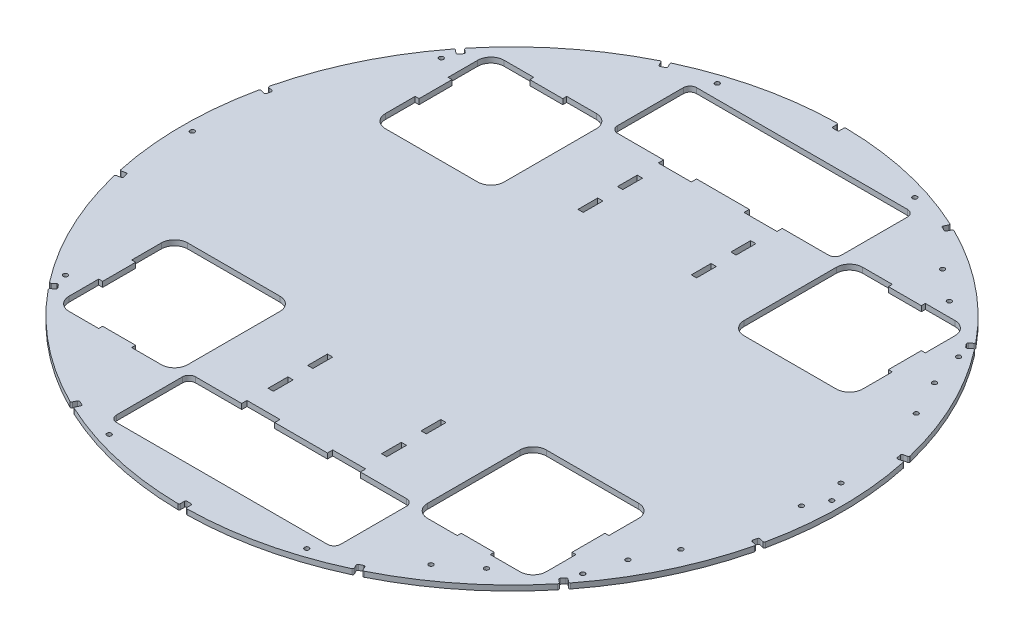
from build123d import *

# Parameters (mm, degrees)
SKETCH1_R                = 250
BOSS_EXTRUDE1_DEPTH      = 4
CUT_EXTRUDE1_DEPTH       = 10
SKETCH3_W                = 25
SKETCH3_H                = 4
CUT_EXTRUDE2_DEPTH       = 5
SKETCH4_W                = 4
SKETCH4_H                = 15
CUT_EXTRUDE3_DEPTH       = 20
CUT_EXTRUDE4_DEPTH       = 5
SKETCH8_W                = 6
SKETCH8_H                = 25
SKETCH8_W_2              = 25
SKETCH8_H_2              = 6
BOSS_EXTRUDE2_DEPTH      = 4
CUT_EXTRUDE5_DEPTH       = 4
FILLET1_R                = 1
CIRPATTERN1_COUNT        = 14
FILLET1_OF_CIRPATTERN1_R = 1
SKETCH12_R               = 1.7
CUT_EXTRUDE6_DEPTH       = 10
CIRPATTERN2_COUNT        = 10
SKETCH13_R               = 1.7
CUT_EXTRUDE7_DEPTH       = 10


with BuildPart() as part:
    # Sketch1 → Boss-Extrude1 (new body)
    with BuildSketch(Plane(origin=(0, 0, 0), x_dir=(1, 0, 0), z_dir=(0, 1, 0))):
        with Locations(Location((0, 0, 0), (0, 0, 270))):
            Circle(SKETCH1_R)
    extrude(amount=BOSS_EXTRUDE1_DEPTH)

    # Sketch2 → Cut-Extrude1 (cut)
    with BuildSketch(Plane(origin=(0, 4, 0), x_dir=(1, 0, 0), z_dir=(0, 1, 0))):
        with BuildLine():
            Line((80, 220), (-80, 220))
            ThreePointArc((-80, 220), (-83.535533906, 218.535533906), (-85, 215))
            Line((-85, 215), (-85, 165))
            ThreePointArc((-85, 165), (-83.535533906, 161.464466094), (-80, 160))
            Line((-80, 160), (80, 160))
            ThreePointArc((80, 160), (83.535533906, 161.464466094), (85, 165))
            Line((85, 165), (85, 215))
            ThreePointArc((85, 215), (83.535533906, 218.535533906), (80, 220))
        make_face()
        with BuildLine():
            Line((85, -215), (85, -165))
            ThreePointArc((85, -165), (83.535533906, -161.464466094), (80, -160))
            Line((80, -160), (-80, -160))
            ThreePointArc((-80, -160), (-83.535533906, -161.464466094), (-85, -165))
            Line((-85, -165), (-85, -215))
            ThreePointArc((-85, -215), (-83.535533906, -218.535533906), (-80, -220))
            Line((-80, -220), (80, -220))
            ThreePointArc((80, -220), (83.535533906, -218.535533906), (85, -215))
        make_face()
    extrude(amount=-CUT_EXTRUDE1_DEPTH, mode=Mode.SUBTRACT)

    # Sketch3 → Cut-Extrude2 (cut)
    with BuildSketch(Plane(origin=(0, 4, 0), x_dir=(1, 0, 0), z_dir=(0, 1, 0))):
        with Locations((-32.5, 158)):
            Rectangle(SKETCH3_W, SKETCH3_H)
        with Locations((32.5, 158)):
            Rectangle(SKETCH3_W, SKETCH3_H)
        with Locations((-32.5, -158)):
            Rectangle(SKETCH3_W, SKETCH3_H)
        with Locations((32.5, -158)):
            Rectangle(SKETCH3_W, SKETCH3_H)
    extrude(amount=-CUT_EXTRUDE2_DEPTH, mode=Mode.SUBTRACT)

    # Sketch4 → Cut-Extrude3 (cut)
    with BuildSketch(Plane(origin=(0, 4, 0), x_dir=(1, 0, 0), z_dir=(0, 1, 0))):
        with Locations((43, 132.5)):
            Rectangle(SKETCH4_W, SKETCH4_H)
        with Locations((43, 102.5)):
            Rectangle(SKETCH4_W, SKETCH4_H)
        with Locations((-43, 132.5)):
            Rectangle(SKETCH4_W, SKETCH4_H)
        with Locations((-43, 102.5)):
            Rectangle(SKETCH4_W, SKETCH4_H)
        with Locations((-43, -102.5)):
            Rectangle(SKETCH4_W, SKETCH4_H)
        with Locations((-43, -132.5)):
            Rectangle(SKETCH4_W, SKETCH4_H)
        with Locations((43, -102.5)):
            Rectangle(SKETCH4_W, SKETCH4_H)
        with Locations((43, -132.5)):
            Rectangle(SKETCH4_W, SKETCH4_H)
    extrude(amount=-CUT_EXTRUDE3_DEPTH, mode=Mode.SUBTRACT)

    # Sketch7 → Cut-Extrude4 (cut)
    with BuildSketch(Plane(origin=(0, 4, 0), x_dir=(1, 0, 0), z_dir=(0, 1, 0))):
        with BuildLine():
            Line((-101, 75), (-171, 75))
            ThreePointArc((-171, 75), (-178.071067812, 77.928932188), (-181, 85))
            Line((-181, 85), (-181, 155))
            ThreePointArc((-181, 155), (-178.071067812, 162.071067812), (-171, 165))
            Line((-171, 165), (-101, 165))
            ThreePointArc((-101, 165), (-93.928932188, 162.071067812), (-91, 155))
            Line((-91, 155), (-91, 85))
            ThreePointArc((-91, 85), (-93.928932188, 77.928932188), (-101, 75))
        make_face()
        with BuildLine():
            Line((181, 85), (181, 155))
            ThreePointArc((181, 155), (178.071067812, 162.071067812), (171, 165))
            Line((171, 165), (101, 165))
            ThreePointArc((101, 165), (93.928932188, 162.071067812), (91, 155))
            Line((91, 155), (91, 85))
            ThreePointArc((91, 85), (93.928932188, 77.928932188), (101, 75))
            Line((101, 75), (171, 75))
            ThreePointArc((171, 75), (178.071067812, 77.928932188), (181, 85))
        make_face()
        with BuildLine():
            Line((101, -75), (171, -75))
            ThreePointArc((171, -75), (178.071067812, -77.928932188), (181, -85))
            Line((181, -85), (181, -155))
            ThreePointArc((181, -155), (178.071067812, -162.071067812), (171, -165))
            Line((171, -165), (101, -165))
            ThreePointArc((101, -165), (93.928932188, -162.071067812), (91, -155))
            Line((91, -155), (91, -85))
            ThreePointArc((91, -85), (93.928932188, -77.928932188), (101, -75))
        make_face()
        with BuildLine():
            Line((-181, -85), (-181, -155))
            ThreePointArc((-181, -155), (-178.071067812, -162.071067812), (-171, -165))
            Line((-171, -165), (-101, -165))
            ThreePointArc((-101, -165), (-93.928932188, -162.071067812), (-91, -155))
            Line((-91, -155), (-91, -85))
            ThreePointArc((-91, -85), (-93.928932188, -77.928932188), (-101, -75))
            Line((-101, -75), (-171, -75))
            ThreePointArc((-171, -75), (-178.071067812, -77.928932188), (-181, -85))
        make_face()
    extrude(amount=-CUT_EXTRUDE4_DEPTH, mode=Mode.SUBTRACT)

    # Sketch8 → Boss-Extrude2 (add)
    with BuildSketch(Plane(origin=(0, 4, 0), x_dir=(1, 0, 0), z_dir=(0, 1, 0))):
        with Locations((-181, 120)):
            Rectangle(SKETCH8_W, SKETCH8_H)
        with Locations((-136, 165)):
            Rectangle(SKETCH8_W_2, SKETCH8_H_2)
        with Locations((136, 165)):
            Rectangle(SKETCH8_W_2, SKETCH8_H_2)
        with Locations((181, 120)):
            Rectangle(SKETCH8_W, SKETCH8_H)
        with Locations((181, -120)):
            Rectangle(SKETCH8_W, SKETCH8_H)
        with Locations((136, -165)):
            Rectangle(SKETCH8_W_2, SKETCH8_H_2)
        with Locations((-136, -165)):
            Rectangle(SKETCH8_W_2, SKETCH8_H_2)
        with Locations((-181, -120)):
            Rectangle(SKETCH8_W, SKETCH8_H)
    extrude(amount=-BOSS_EXTRUDE2_DEPTH)

    # Sketch11 → Cut-Extrude5 (cut)
    with BuildSketch(Plane(origin=(0, 4, 0), x_dir=(1, 0, 0), z_dir=(0, 1, 0))):
        with BuildLine():
            Line((1.5, 245), (-1.5, 245))
            ThreePointArc((-1.5, 245), (-2.207106781, 245.292893219), (-2.5, 246))
            Line((-2.5, 246), (-2.5, 255))
            Line((-2.5, 255), (2.5, 255))
            Line((2.5, 255), (2.5, 246))
            ThreePointArc((2.5, 246), (2.207106781, 245.292893219), (1.5, 245))
        make_face()
    cut_extrude5 = extrude(amount=-CUT_EXTRUDE5_DEPTH, mode=Mode.SUBTRACT)

    # Fillet1
    fillet1_edges = [part.edges().sort_by_distance(p)[0] for p in [
        (2.5, 2, -249.987499687),
        (-2.5, 2, -249.987499687),
    ]]
    fillet(fillet1_edges, radius=FILLET1_R)

    # CirPattern1: Cut-Extrude5 ×14 about axis
    cirpattern1_axis = Axis((0, 0, 0), (0, 1, 0))
    for i in range(1, CIRPATTERN1_COUNT):
        add(cut_extrude5.rotate(cirpattern1_axis, i * 360 / CIRPATTERN1_COUNT), mode=Mode.SUBTRACT)

    # Fillet1 of CirPattern1
    fillet1_of_cirpattern1_edges = [part.edges().sort_by_distance(p)[0] for p in [
        (-106.213088927, 2, -226.315663931),
        (-110.717933267, 2, -224.146245235),
        (-193.889372974, 2, -157.819235353),
        (-197.006821984, 2, -153.910077941),
        (-243.163488807, 2, -58.064771688),
        (-244.276093477, 2, -53.190132127),
        (-244.276093477, 2, 53.190132127),
        (-243.163488807, 2, 58.064771688),
        (-197.006821984, 2, 153.910077941),
        (-193.889372974, 2, 157.819235353),
        (-110.717933267, 2, 224.146245235),
        (-106.213088927, 2, 226.315663931),
        (-2.5, 2, 249.987499687),
        (2.5, 2, 249.987499687),
        (106.213088927, 2, 226.315663931),
        (110.717933267, 2, 224.146245235),
        (193.889372974, 2, 157.819235353),
        (197.006821984, 2, 153.910077941),
        (243.163488807, 2, 58.064771688),
        (244.276093477, 2, 53.190132127),
        (244.276093477, 2, -53.190132127),
        (243.163488807, 2, -58.064771688),
        (197.006821984, 2, -153.910077941),
        (193.889372974, 2, -157.819235353),
        (110.717933267, 2, -224.146245235),
        (106.213088927, 2, -226.315663931),
    ]]
    fillet(fillet1_of_cirpattern1_edges, radius=FILLET1_OF_CIRPATTERN1_R)

    # Sketch12 → Cut-Extrude6 (cut)
    with BuildSketch(Plane(origin=(0, 4, 0), x_dir=(1, 0, 0), z_dir=(0, 1, 0))):
        with Locations(Location((-242.5, 0, 0), (0, 0, 270))):
            Circle(SKETCH12_R)
    cut_extrude6 = extrude(amount=-CUT_EXTRUDE6_DEPTH, mode=Mode.SUBTRACT)

    # CirPattern2: Cut-Extrude6 ×10 about axis
    cirpattern2_axis = Axis((0, 0, 0), (0, 1, 0))
    for i in range(1, CIRPATTERN2_COUNT):
        add(cut_extrude6.rotate(cirpattern2_axis, i * 360 / CIRPATTERN2_COUNT), mode=Mode.SUBTRACT)

    # Sketch13 → Cut-Extrude7 (cut)
    with BuildSketch(Plane(origin=(0, 4, 0), x_dir=(1, 0, 0), z_dir=(0, 1, 0))):
        with Locations(Location((234.5, 15, 0), (0, 0, 270))):
            Circle(SKETCH13_R)
        with Locations(Location((234.5, -15, 0), (0, 0, 270))):
            Circle(SKETCH13_R)
        with Locations(Location((217.342771059, -89.316123228, 0), (0, 0, 270))):
            Circle(SKETCH13_R)
        with Locations(Location((204.191636655, -116.279944617, 0), (0, 0, 270))):
            Circle(SKETCH13_R)
        with Locations(Location((156.192777268, -175.553599591, 0), (0, 0, 270))):
            Circle(SKETCH13_R)
        with Locations(Location((132.55245466, -194.023443851, 0), (0, 0, 270))):
            Circle(SKETCH13_R)
        with Locations(Location((204.191636655, 116.279944617, 0), (0, 0, 270))):
            Circle(SKETCH13_R)
        with Locations(Location((217.342771059, 89.316123228, 0), (0, 0, 270))):
            Circle(SKETCH13_R)
        with Locations(Location((132.55245466, 194.023443851, 0), (0, 0, 270))):
            Circle(SKETCH13_R)
        with Locations(Location((156.192777268, 175.553599591, 0), (0, 0, 270))):
            Circle(SKETCH13_R)
    extrude(amount=-CUT_EXTRUDE7_DEPTH, mode=Mode.SUBTRACT)


solid = part.part
